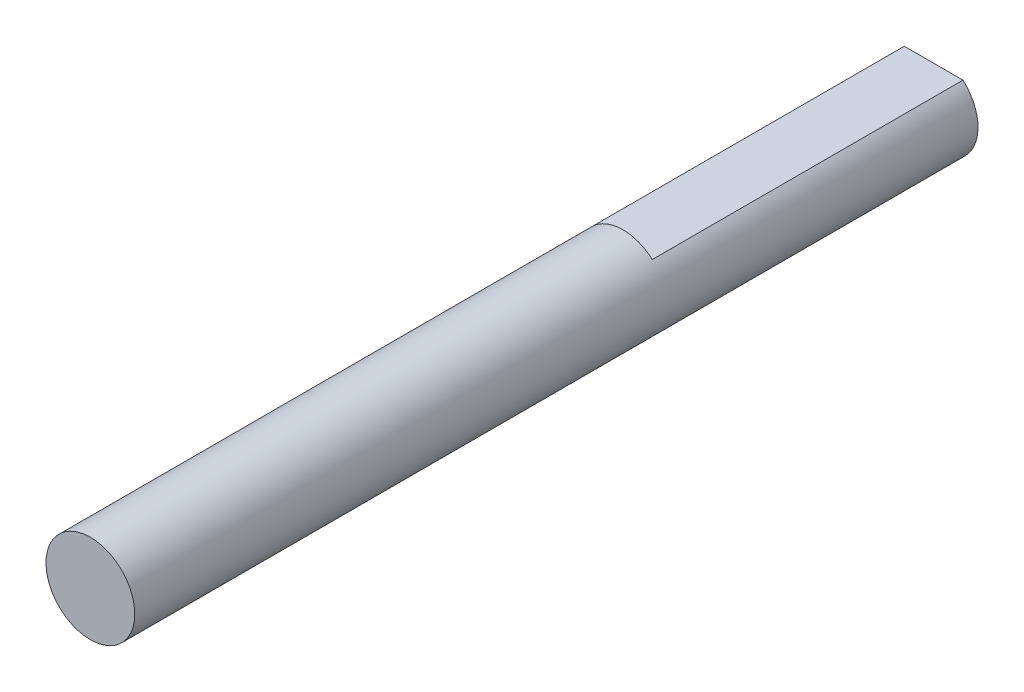
from build123d import *

# Parameters (mm, degrees)
SKETCH1_R           = 2
BOSS_EXTRUDE2_DEPTH = 24
BOSS_EXTRUDE3_START = -14
BOSS_EXTRUDE3_DEPTH = 14


with BuildPart() as part:
    # Sketch1 → Boss-Extrude2 (new body)
    with BuildSketch(Plane.XY):
        Circle(SKETCH1_R)
    extrude(amount=BOSS_EXTRUDE2_DEPTH)

    # Sketch1<4> → Boss-Extrude3 (add)
    with BuildSketch(Plane.XY.offset(BOSS_EXTRUDE3_START)):
        with BuildLine():
            Line((1.322875656, 1.5), (-1.322875656, 1.5))
            ThreePointArc((-1.322875656, 1.5), (-0.822875656, -1.822875656), (2, 0))
            ThreePointArc((2, 0), (1.822875656, 0.822875656), (1.322875656, 1.5))
        make_face()
    extrude(amount=BOSS_EXTRUDE3_DEPTH)


solid = part.part
